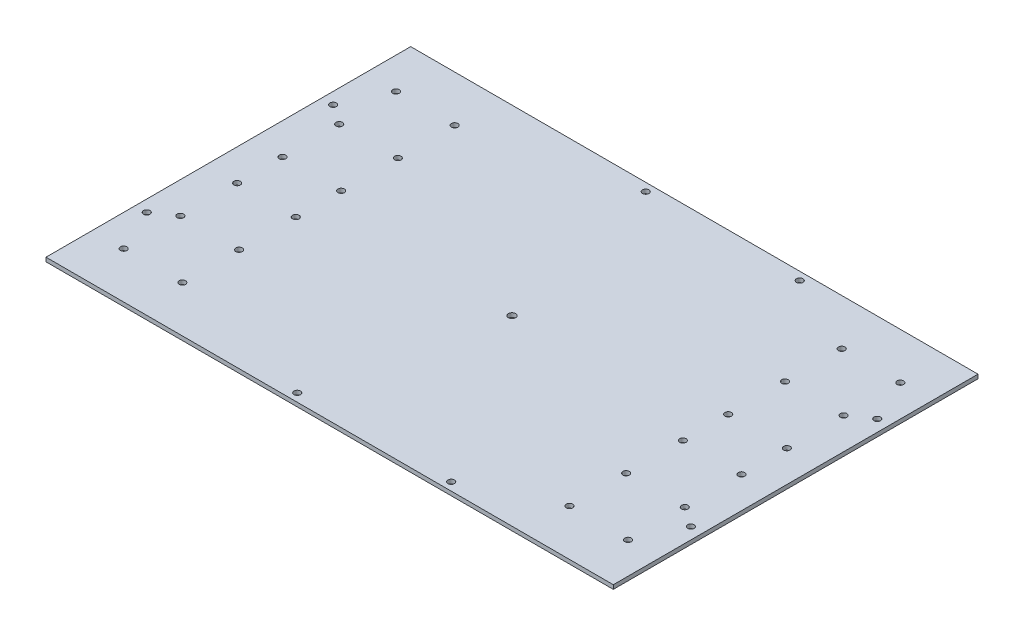
from build123d import *

# Parameters (mm, degrees)
SKETCH2_W               = 700
SKETCH2_H               = 450
BOSS_EXTRUDE1_DEPTH     = 2.5
SKETCH6_R               = 4
CUT_EXTRUDE2_DEPTH      = 417.112965431
CUT_EXTRUDE4_REACH      = 418.113
SKETCH8_R               = 4.5
SKETCH9_R               = 4
CUT_EXTRUDE5_DEPTH      = 417.112965431
CUT_EXTRUDE6_DEPTH      = 417.112965431
CUT_EXTRUDE6_DEPTH_BACK = 417.112965431
SKETCH10_R              = 4


with BuildPart() as part:
    # Sketch2 → Boss-Extrude1 (new, symmetric)
    with BuildSketch(Plane(origin=(0, 0, 0), x_dir=(1, 0, 0), z_dir=(0, 1, 0))):
        Rectangle(SKETCH2_W, SKETCH2_H)
    extrude(amount=BOSS_EXTRUDE1_DEPTH, both=True)

    # Sketch6 → Cut-Extrude2 (cut, through all)
    with BuildSketch(Plane(origin=(0, 2.5, 0), x_dir=(1, 0, 0), z_dir=(0, 1, 0))):
        with Locations(Location((-311.203103448, 168, 0), (0, 0, 270))):
            Circle(SKETCH6_R)
        with Locations(Location((-238.793103448, 168, 0), (0, 0, 270))):
            Circle(SKETCH6_R)
        with Locations(Location((-238.793103448, 98, 0), (0, 0, 270))):
            Circle(SKETCH6_R)
        with Locations(Location((-311.203103448, 98, 0), (0, 0, 270))):
            Circle(SKETCH6_R)
        with Locations(Location((-311.203103448, 28, 0), (0, 0, 270))):
            Circle(SKETCH6_R)
        with Locations(Location((-238.793103448, 28, 0), (0, 0, 270))):
            Circle(SKETCH6_R)
        with Locations(Location((238.793103448, 168, 0), (0, 0, 270))):
            Circle(SKETCH6_R)
        with Locations(Location((311.203103448, 168, 0), (0, 0, 270))):
            Circle(SKETCH6_R)
        with Locations(Location((311.203103448, 98, 0), (0, 0, 270))):
            Circle(SKETCH6_R)
        with Locations(Location((238.793103448, 98, 0), (0, 0, 270))):
            Circle(SKETCH6_R)
        with Locations(Location((238.793103448, 28, 0), (0, 0, 270))):
            Circle(SKETCH6_R)
        with Locations(Location((311.203103448, 28, 0), (0, 0, 270))):
            Circle(SKETCH6_R)
        with Locations(Location((-311.203103448, -28, 0), (0, 0, 270))):
            Circle(SKETCH6_R)
        with Locations(Location((-238.793103448, -28, 0), (0, 0, 270))):
            Circle(SKETCH6_R)
        with Locations(Location((-238.793103448, -98, 0), (0, 0, 270))):
            Circle(SKETCH6_R)
        with Locations(Location((-311.203103448, -98, 0), (0, 0, 270))):
            Circle(SKETCH6_R)
        with Locations(Location((-311.203103448, -168, 0), (0, 0, 270))):
            Circle(SKETCH6_R)
        with Locations(Location((-238.793103448, -168, 0), (0, 0, 270))):
            Circle(SKETCH6_R)
        with Locations(Location((238.793103448, -28, 0), (0, 0, 270))):
            Circle(SKETCH6_R)
        with Locations(Location((311.203103448, -28, 0), (0, 0, 270))):
            Circle(SKETCH6_R)
        with Locations(Location((311.203103448, -98, 0), (0, 0, 270))):
            Circle(SKETCH6_R)
        with Locations(Location((238.793103448, -98, 0), (0, 0, 270))):
            Circle(SKETCH6_R)
        with Locations(Location((238.793103448, -168, 0), (0, 0, 270))):
            Circle(SKETCH6_R)
        with Locations(Location((311.203103448, -168, 0), (0, 0, 270))):
            Circle(SKETCH6_R)
    extrude(amount=-CUT_EXTRUDE2_DEPTH, mode=Mode.SUBTRACT)

    # Sketch8 → Cut-Extrude4 (cut, up to next)
    with BuildSketch(Plane(origin=(0, 2.5, 0), x_dir=(1, 0, 0), z_dir=(0, 1, 0)), mode=Mode.PRIVATE) as cut_extrude4_sk1:
        with Locations(Location((0, 0, 0), (0, 0, 270))):
            Circle(SKETCH8_R)
    cut_extrude4_tool1 = extrude(cut_extrude4_sk1.sketch, amount=-CUT_EXTRUDE4_REACH, mode=Mode.PRIVATE) & part.part
    add(cut_extrude4_tool1.solids().sort_by_distance((0, 2.5, 0))[0], mode=Mode.SUBTRACT)

    # Sketch9 → Cut-Extrude5 (cut, through all)
    with BuildSketch(Plane(origin=(0, 2.5, 0), x_dir=(1, 0, 0), z_dir=(0, 1, 0))):
        with Locations(Location((-50, -215, 0), (0, 0, 270))):
            Circle(SKETCH9_R)
        with Locations(Location((140, -215, 0), (0, 0, 270))):
            Circle(SKETCH9_R)
        with Locations(Location((-50, 215, 0), (0, 0, 270))):
            Circle(SKETCH9_R)
        with Locations(Location((140, 215, 0), (0, 0, 270))):
            Circle(SKETCH9_R)
    extrude(amount=-CUT_EXTRUDE5_DEPTH, mode=Mode.SUBTRACT)

    # Sketch10 → Cut-Extrude6 (cut, two sides: drawn at the far end of the back side and taken through both)
    with BuildSketch(Plane(origin=(0, 2.5, 0), x_dir=(1, 0, 0), z_dir=(0, 1, 0)).offset(-CUT_EXTRUDE6_DEPTH_BACK)):
        with Locations(Location((-335.68, 115, 0), (0, 0, 270))):
            Circle(SKETCH10_R)
        with Locations(Location((-335.68, -115, 0), (0, 0, 270))):
            Circle(SKETCH10_R)
        with Locations(Location((335.68, 115, 0), (0, 0, 270))):
            Circle(SKETCH10_R)
        with Locations(Location((335.68, -115, 0), (0, 0, 270))):
            Circle(SKETCH10_R)
    extrude(amount=CUT_EXTRUDE6_DEPTH + CUT_EXTRUDE6_DEPTH_BACK, mode=Mode.SUBTRACT)


solid = part.part
